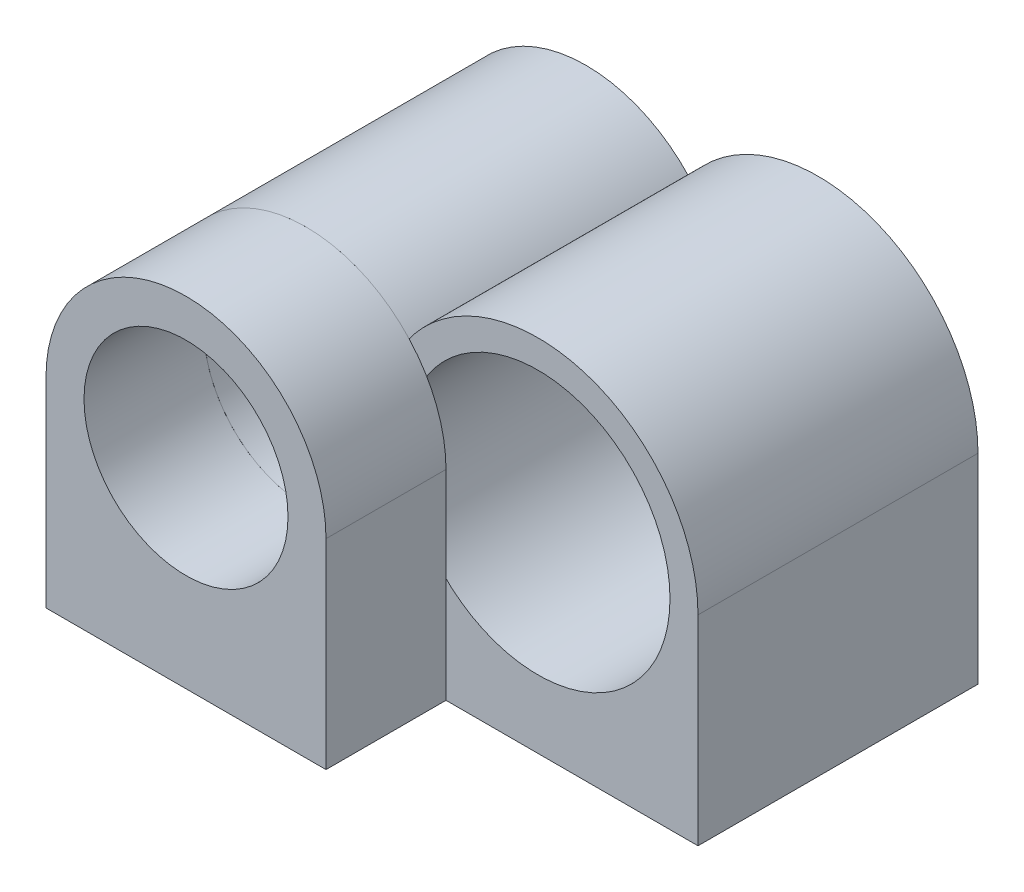
from build123d import *

# Parameters (mm, degrees)
SKETCH1_R            = 3.3
BOSS_EXTRUDE1_DEPTH  = 7
SKETCH2_R            = 2.55
BOSS_EXTRUDE4_DEPTH  = 3
BOSS_EXTRUDE10_DEPTH = 7


with BuildPart() as part:
    # Sketch1 → Boss-Extrude1 (new body)
    with BuildSketch(Plane.XY):
        with BuildLine():
            Line((-4, 0), (-4, -5))
            Line((-4, -5), (4, -5))
            Line((4, -5), (4, 0))
            ThreePointArc((4, 0), (0, 4), (-4, 0))
        make_face()
        with Locations(Location((0, 0, 0), (0, 0, 180))):
            Circle(SKETCH1_R, mode=Mode.SUBTRACT)
    extrude(amount=BOSS_EXTRUDE1_DEPTH)


with BuildPart() as body_2:
    # Sketch2 → Boss-Extrude4 (new body)
    with BuildSketch(Plane.XY.offset(7)):
        with BuildLine():
            Line((-9.3, 0), (-9.3, -5))
            Line((-9.3, -5), (-4, -5))
            Line((-4, -5), (-2.3, -5))
            Line((-2.3, -5), (-2.3, 0))
            ThreePointArc((-2.3, 0), (-5.8, 3.5), (-9.3, 0))
        make_face()
        with Locations((-5.8, 0)):
            Circle(SKETCH2_R, mode=Mode.SUBTRACT)
    extrude(amount=BOSS_EXTRUDE4_DEPTH)


with BuildPart() as body_3:
    # Sketch6 → Boss-Extrude10 (new body)
    with BuildSketch(Plane(origin=(0, 0, 7), x_dir=(-1, 0, 0), z_dir=(0, 0, -1))):
        with BuildLine():
            ThreePointArc((8.35, 0), (6.777880361, -2.35504777), (4, -1.806239187))
            Line((4, -1.806239187), (4, -5))
            Line((4, -5), (9.3, -5))
            Line((9.3, -5), (9.3, 0))
            ThreePointArc((9.3, 0), (7.07111477, 3.261022423), (3.223275862, 2.368647867))
            ThreePointArc((3.223275862, 2.368647867), (3.49975704, 1.936930732), (3.71875, 1.473396904))
            ThreePointArc((3.71875, 1.473396904), (6.573082305, 2.429988426), (8.35, 0))
        make_face()
    extrude(amount=BOSS_EXTRUDE10_DEPTH)


solid = Compound([part.part, body_2.part, body_3.part])
